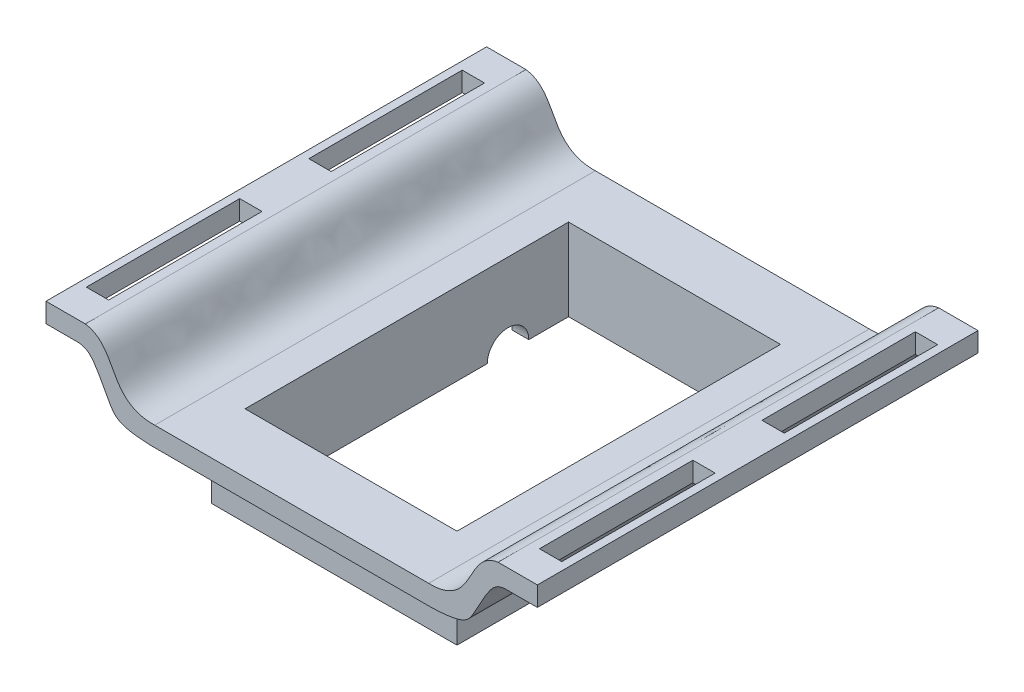
from build123d import *

# Parameters (mm, degrees)
BOSS_EXTRUDE1_DEPTH = 79
SKETCH2_W           = 38
SKETCH2_H           = 58
CUT_EXTRUDE1_DEPTH  = 79
SKETCH2_4_W         = 44
SKETCH2_4_H         = 64
SKETCH2_4_W_2       = 38
SKETCH2_4_H_2       = 58
BOSS_EXTRUDE2_DEPTH = 11.2
SKETCH3_W           = 4
SKETCH3_H           = 27.5
CUT_EXTRUDE2_DEPTH  = 11.2
SKETCH4_R           = 3.719736595
CUT_EXTRUDE3_DEPTH  = 11.2


with BuildPart() as part:
    # Sketch1 → Boss-Extrude1 (new body)
    with BuildSketch(Plane.XY):
        with BuildLine():
            add(Edge.make_bspline(
                [(-24.556789143, -15), (-27.745261791, -15.088777555), (-32.116523574, -12.134311448), (-33.438353398, -6.048030585), (-37, -5.5)],
                knots=[0.971548373, 0.971548373, 0.971548373, 0.971548373, 1.403552773, 1.971548373, 1.971548373, 1.971548373, 1.971548373], degree=3))
            Line((-37, -5.5), (-44.050427966, -5.5))
            Line((-44.050427966, -5.5), (-44.050427966, -9))
            Line((-44.050427966, -9), (-38.622212975, -9))
            add(Edge.make_bspline(
                [(-38.622212975, -9), (-37.013577383, -8.940166603), (-35.066707272, -10.728314314), (-32.367433587, -16.596409153), (-30.698617033, -18.287184956), (-25.17005526, -18.5)],
                knots=[0, 0, 0, 0, 0.269469322, 0.622038388, 1, 1, 1, 1], degree=3))
            Line((-25.17005526, -18.5), (25.17005526, -18.5))
            add(Edge.make_bspline(
                [(38.622212975, -9), (37.013577383, -8.940166603), (35.066707272, -10.728314314), (32.367433587, -16.596409153), (30.698617033, -18.287184956), (25.17005526, -18.5)],
                knots=[0, 0, 0, 0, 0.269469322, 0.622038388, 1, 1, 1, 1], degree=3))
            Line((38.622212975, -9), (44.050427966, -9))
            Line((44.050427966, -9), (44.050427966, -5.5))
            Line((44.050427966, -5.5), (37, -5.5))
            add(Edge.make_bspline(
                [(37, -5.5), (33.438353398, -6.048030585), (32.116523574, -12.134311448), (27.745261791, -15.088777555), (24.556789143, -15)],
                knots=[0, 0, 0, 0, 0.5679956, 1, 1, 1, 1], degree=3))
            Line((24.556789143, -15), (-24.556789143, -15))
        make_face()
    extrude(amount=BOSS_EXTRUDE1_DEPTH)

    # Sketch2 → Cut-Extrude1 (cut)
    with BuildSketch(Plane.XZ.offset(18.5)):
        with Locations((0, 39.360513879)):
            Rectangle(SKETCH2_W, SKETCH2_H)
    extrude(amount=-CUT_EXTRUDE1_DEPTH, mode=Mode.SUBTRACT)

    # Sketch2<4> → Boss-Extrude2 (add)
    with BuildSketch(Plane.XZ.offset(18.5)):
        with Locations((0, 39.360513879)):
            Rectangle(SKETCH2_4_W, SKETCH2_4_H)
        with Locations((0, 39.360513879)):
            Rectangle(SKETCH2_4_W_2, SKETCH2_4_H_2, mode=Mode.SUBTRACT)
    extrude(amount=BOSS_EXTRUDE2_DEPTH)

    # Sketch3 → Cut-Extrude2 (cut)
    with BuildSketch(Plane.XZ.offset(9)):
        with Locations((40.622212975, 59.446790211)):
            Rectangle(SKETCH3_W, SKETCH3_H)
        with Locations((40.622212975, 19.553209789)):
            Rectangle(SKETCH3_W, SKETCH3_H)
    cut_extrude2 = extrude(amount=-CUT_EXTRUDE2_DEPTH, mode=Mode.SUBTRACT)

    # Sketch4 → Cut-Extrude3 (cut)
    with BuildSketch(Plane.ZY.offset(22)):
        with Locations((21.211295074, -29.7)):
            Circle(SKETCH4_R)
    extrude(amount=-CUT_EXTRUDE3_DEPTH, mode=Mode.SUBTRACT)

    # Mirror1: Cut-Extrude2 across plane
    add(cut_extrude2.mirror(Plane(origin=(0, 0, 0), x_dir=(0, 0, 1), z_dir=(1, 0, 0))), mode=Mode.SUBTRACT)


solid = part.part
